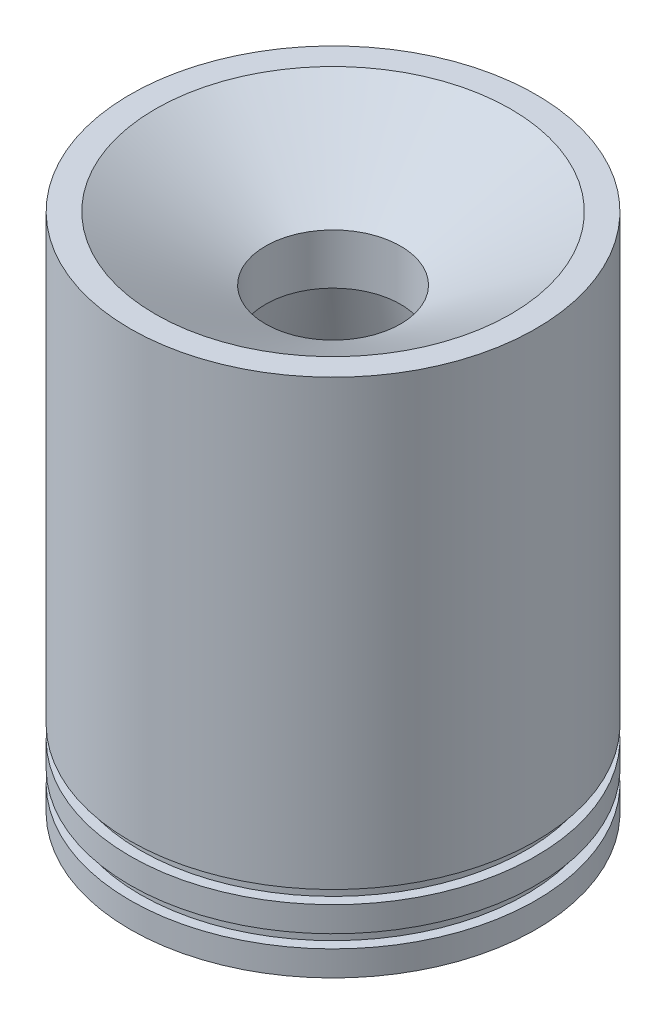
from build123d import *


with BuildPart() as part:
    # Sketch1 → Revolve1 (revolve)
    with BuildSketch(Plane.XY, mode=Mode.PRIVATE) as revolve1_sk:
        Polygon((-51.1302, 0), (-51.1302, -111.802131397), (-48.5902, -111.802131397), (-48.5902, -115.104131397), (-51.1302, -115.104131397), (-51.1302, -121.454131397), (-48.5902, -121.454131397), (-48.5902, -124.756131397), (-51.1302, -124.756131397), (-51.1302, -131.106131397), (-44.45, -131.106131397), (-17.018, -28.728513643), (-17.018, -16.028513643), (-44.7802, 0), align=None)
    revolve(revolve1_sk.sketch.rotate(Axis((0, 0, 0), (0, -1, 0)), 270), axis=Axis((0, 0, 0), (0, -1, 0)))


solid = part.part
